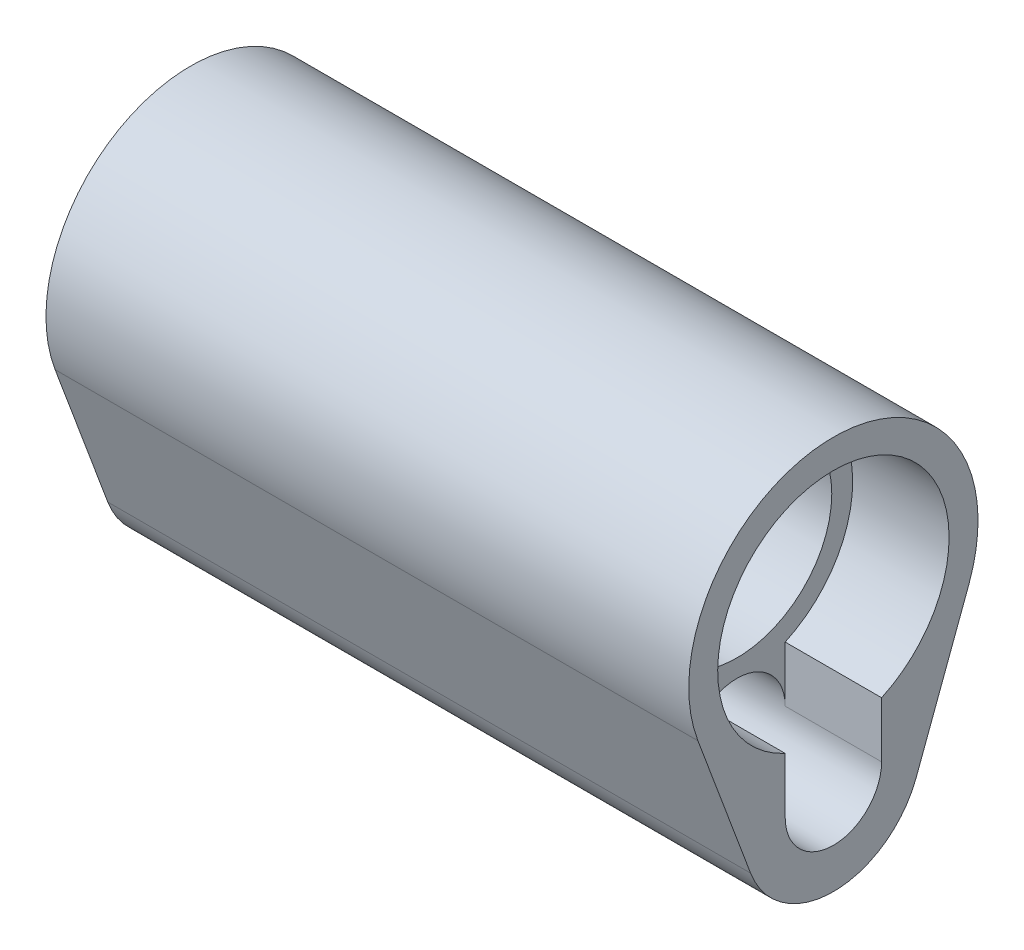
from build123d import *

# Parameters (mm, degrees)
SKETCH_1_R          = 2.95
SKETCH_1_R_2        = 1.5
EXTRUDE_1_DEPTH     = 20
CUT_EXTRUDE_1_DEPTH = 3


with BuildPart() as part:
    # Эскиз1 → Бобышка-Вытянуть1 (new body)
    with BuildSketch(Plane(origin=(0, 0, 0), x_dir=(0, 0, -1), z_dir=(1, 0, 0))):
        with BuildLine():
            Line((-4.215373649, -1.575), (-2.576061674, -5.9625))
            ThreePointArc((-2.576061674, -5.9625), (0, -7.75), (2.576061674, -5.9625))
            Line((2.576061674, -5.9625), (4.215373649, -1.575))
            ThreePointArc((4.215373649, -1.575), (0, 4.5), (-4.215373649, -1.575))
        make_face()
        Circle(SKETCH_1_R, mode=Mode.SUBTRACT)
        with Locations((0, -5)):
            Circle(SKETCH_1_R_2, mode=Mode.SUBTRACT)
    extrude(amount=EXTRUDE_1_DEPTH)

    # Эскиз2 → Вырез-Вытянуть1 (cut)
    with BuildSketch(Plane(origin=(20, 0, 0), x_dir=(0, 0, -1), z_dir=(1, 0, 0))):
        with BuildLine():
            Line((-1.5, -5), (1.5, -5))
            Line((1.5, -5), (1.5, -3.272613634))
            ThreePointArc((1.5, -3.272613634), (0, 3.6), (-1.5, -3.272613634))
            Line((-1.5, -3.272613634), (-1.5, -5))
        make_face()
    extrude(amount=-CUT_EXTRUDE_1_DEPTH, mode=Mode.SUBTRACT)


solid = part.part
